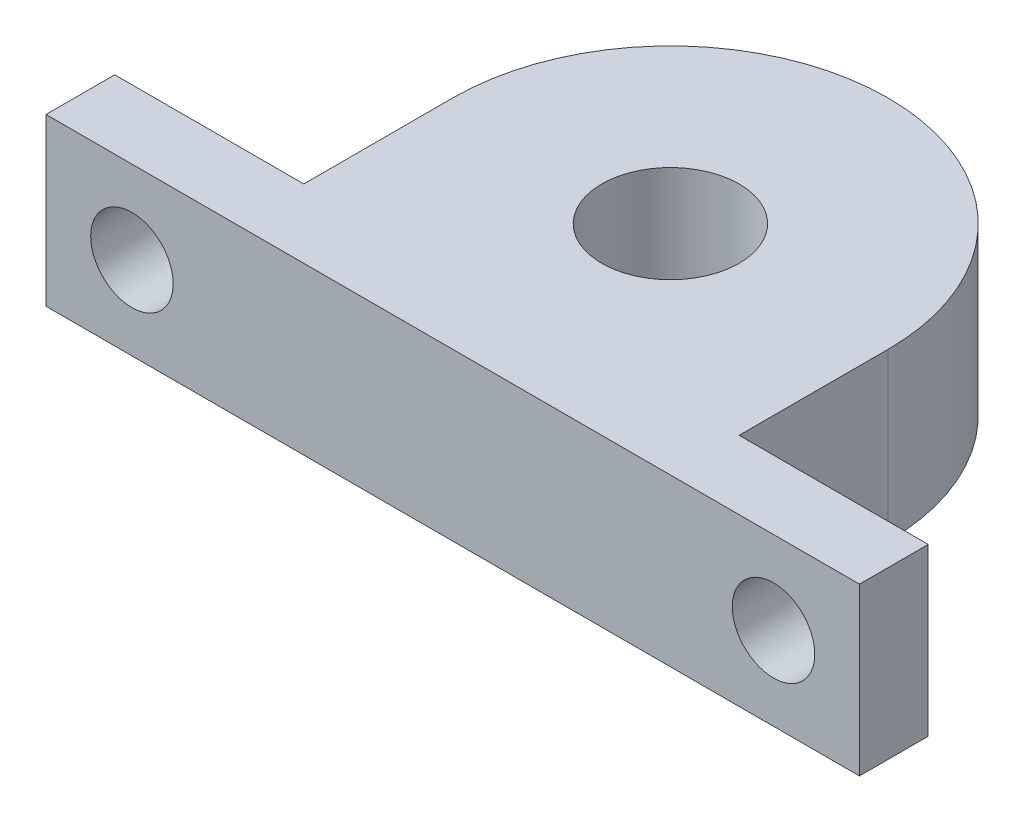
from build123d import *

# Parameters (mm, degrees)
EXTRUDE_2_DEPTH     = 14.5
SKETCH_2_R          = 3.6
CUT_EXTRUDE_1_DEPTH = 14.5


with BuildPart() as part:
    # 草图1 → 凸台-拉伸2 (new body)
    with BuildSketch(Plane(origin=(0, 0, 0), x_dir=(1, 0, 0), z_dir=(0, 1, 0))):
        with BuildLine():
            ThreePointArc((-13.856406461, -13), (-7.549834433, -17.435595775), (5e-09, -19))
            Line((0, -19), (0, -6))
            ThreePointArc((0, -6), (-6, 0), (0, 6))
            Line((0, 6), (0, 19))
            ThreePointArc((0, 19), (-13.435028843, 13.435028843), (-19, 0))
            ThreePointArc((-19, 0), (-17.667367132, -6.99028888), (-13.856406461, -13))
        make_face()
        with BuildLine():
            Line((0, -6), (0, -19))
            ThreePointArc((5e-09, -19), (7.549834438, -17.435595773), (13.856406461, -13))
            ThreePointArc((13.856406461, -13), (17.667367132, -6.99028888), (19, 0))
            ThreePointArc((19, 0), (13.435028843, 13.435028843), (0, 19))
            Line((0, 19), (0, 6))
            ThreePointArc((0, 6), (4.242640687, 4.242640687), (6, 0))
            ThreePointArc((6, 0), (4.242640687, -4.242640687), (0, -6))
        make_face()
        with BuildLine():
            Line((-19, -13), (-13.856406461, -13))
            ThreePointArc((-13.856406461, -13), (-17.667367132, -6.99028888), (-19, 0))
            Line((-19, 0), (-19, -13))
        make_face()
        with BuildLine():
            ThreePointArc((19, 0), (17.667367132, -6.99028888), (13.856406461, -13))
            Line((13.856406461, -13), (19, -13))
            Line((19, -13), (19, 0))
        make_face()
        with BuildLine():
            Line((5e-09, -19), (35.5, -19))
            Line((35.5, -19), (35.5, -13))
            Line((35.5, -13), (19, -13))
            Line((19, -13), (13.856406461, -13))
            ThreePointArc((13.856406461, -13), (7.549834438, -17.435595773), (5e-09, -19))
        make_face()
        with BuildLine():
            Line((-35.5, -19), (5e-09, -19))
            ThreePointArc((5e-09, -19), (-7.549834433, -17.435595775), (-13.856406461, -13))
            Line((-13.856406461, -13), (-19, -13))
            Line((-19, -13), (-35.5, -13))
            Line((-35.5, -13), (-35.5, -19))
        make_face()
    extrude(amount=EXTRUDE_2_DEPTH)

    # 草图2 → 切除-拉伸1 (cut)
    with BuildSketch(Plane(origin=(0, 0, 13), x_dir=(-1, 0, 0), z_dir=(0, 0, -1))):
        with Locations((-28, 7.25)):
            Circle(SKETCH_2_R)
        with Locations((28, 7.25)):
            Circle(SKETCH_2_R)
    extrude(amount=-CUT_EXTRUDE_1_DEPTH, mode=Mode.SUBTRACT)


solid = part.part
